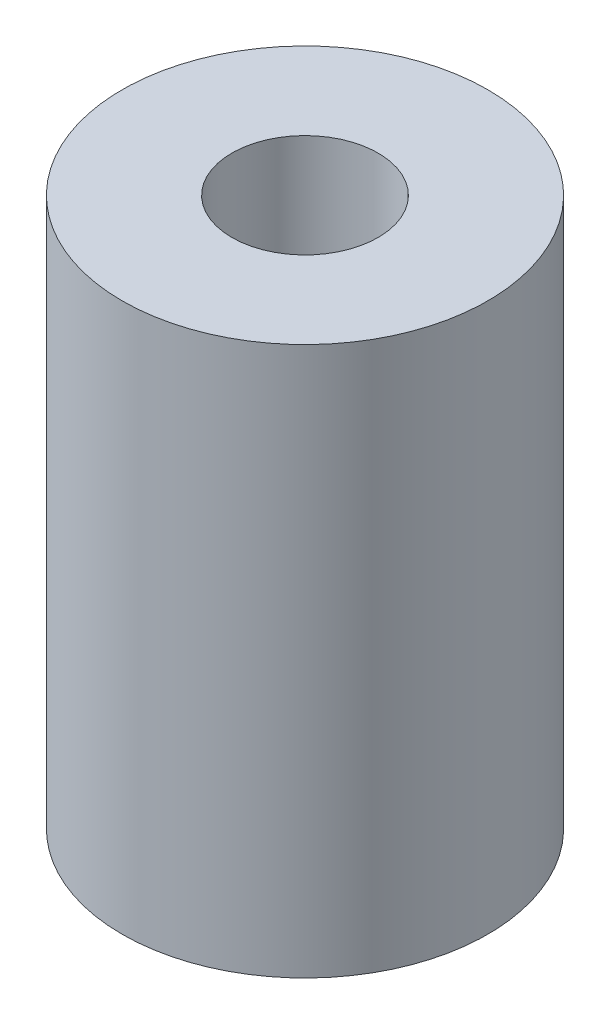
from build123d import *

# Parameters (mm, degrees)
SKETCH2_R           = 7.9375
SKETCH2_R_2         = 3.175
BOSS_EXTRUDE1_DEPTH = 23.8125


with BuildPart() as part:
    # Sketch2 → Boss-Extrude1 (new body)
    with BuildSketch(Plane(origin=(0, 0, 0), x_dir=(1, 0, 0), z_dir=(0, 1, 0))):
        with Locations(Location((0, 0, 0), (0, 0, 270))):
            Circle(SKETCH2_R)
        with Locations(Location((0, 0, 0), (0, 0, 270))):
            Circle(SKETCH2_R_2, mode=Mode.SUBTRACT)
    extrude(amount=BOSS_EXTRUDE1_DEPTH)


solid = part.part
